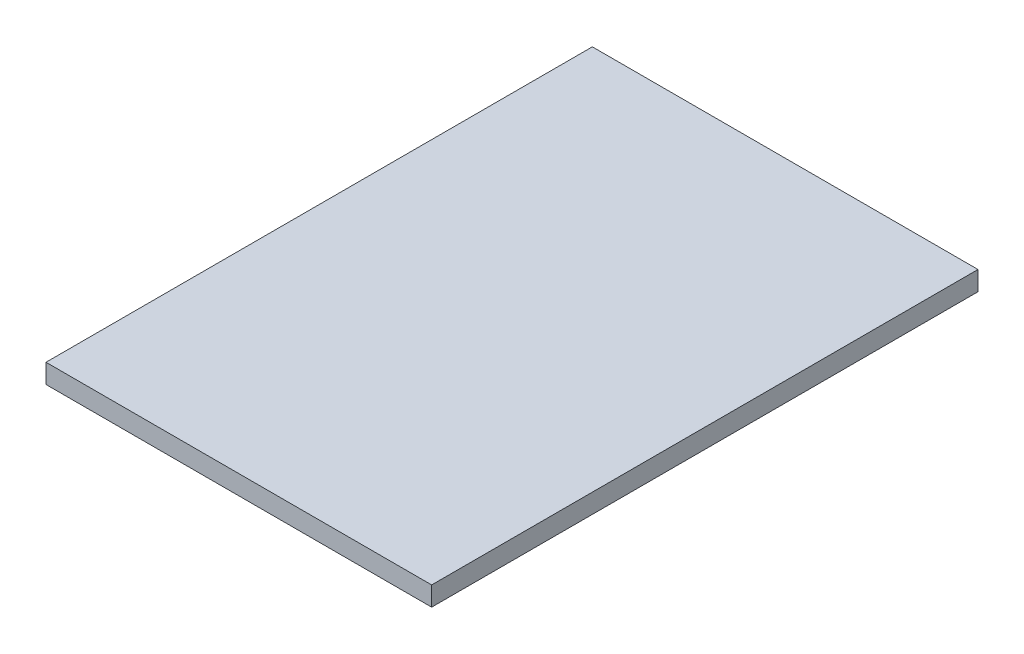
from build123d import *

# Parameters (mm, degrees)
SKETCH_1_W      = 60
SKETCH_1_H      = 85
EXTRUDE_1_DEPTH = 3


with BuildPart() as part:
    # Эскиз1 → Бобышка-Вытянуть1 (new body)
    with BuildSketch(Plane(origin=(0, 0, 0), x_dir=(1, 0, 0), z_dir=(0, 1, 0))):
        with Locations((34, -42.5)):
            Rectangle(SKETCH_1_W, SKETCH_1_H)
    extrude(amount=EXTRUDE_1_DEPTH)


solid = part.part
